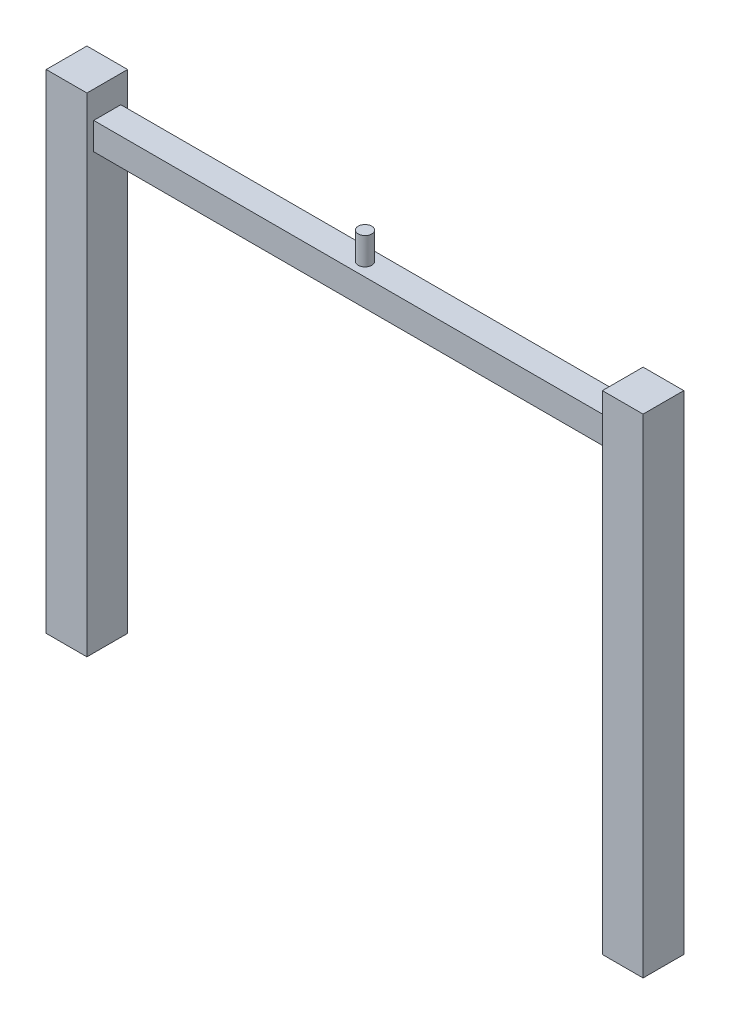
from build123d import *

# Parameters (mm, degrees)
SKETCH1_W             = 38.1
SKETCH1_H             = 38.1
BOSS_EXTRUDE1_DEPTH   = 457.2
BOSS_EXTRUDE1_2_DEPTH = 457.2
SKETCH2_W             = 25.4
SKETCH2_H             = 25.4
BOSS_EXTRUDE2_DEPTH   = 521.97
BOSS_EXTRUDE3_START   = 431.8
SKETCH3_R             = 6.35
BOSS_EXTRUDE3_DEPTH   = 25.4


with BuildPart() as part:
    # Sketch1 → Boss-Extrude1 (new body)
    with BuildSketch(Plane(origin=(0, 0, 0), x_dir=(1, 0, 0), z_dir=(0, 1, 0))):
        with Locations((-260.35, 0)):
            Rectangle(SKETCH1_W, SKETCH1_H)
    extrude(amount=BOSS_EXTRUDE1_DEPTH)



with BuildPart() as body_2:
    # Sketch1 → Boss-Extrude1 2 (new body)
    with BuildSketch(Plane(origin=(0, 0, 0), x_dir=(1, 0, 0), z_dir=(0, 1, 0))):
        with Locations((260.35, 0)):
            Rectangle(SKETCH1_W, SKETCH1_H)
    extrude(amount=BOSS_EXTRUDE1_2_DEPTH)


with BuildPart() as part_1:
    add(part.part)

    add(body_2.part)  # Boss-Extrude2 merges body 2
    # Sketch2 → Boss-Extrude2 (add)
    with BuildSketch(Plane(origin=(279.4, 0, 0), x_dir=(0, 0, -1), z_dir=(1, 0, 0))):
        with Locations((0, 419.1)):
            Rectangle(SKETCH2_W, SKETCH2_H)
    extrude(amount=-BOSS_EXTRUDE2_DEPTH)

    # Sketch3 → Boss-Extrude3 (add)
    with BuildSketch(Plane(origin=(0, 0, 0), x_dir=(1, 0, 0), z_dir=(0, 1, 0)).offset(BOSS_EXTRUDE3_START)):
        with Locations(Location((0, 0, 0), (0, 0, 270))):
            Circle(SKETCH3_R)
    extrude(amount=BOSS_EXTRUDE3_DEPTH)


solid = part_1.part
